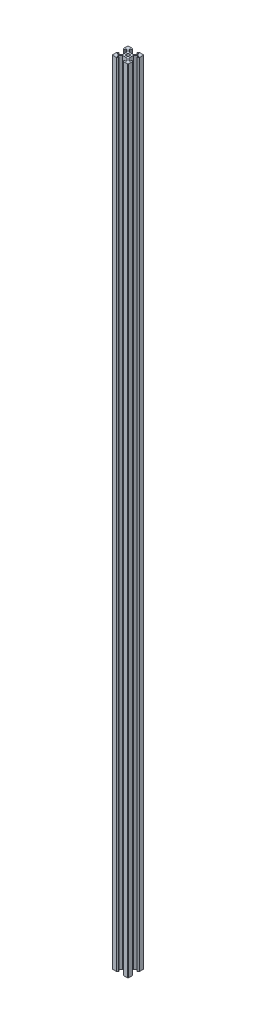
from build123d import *

# Parameters (mm, degrees)
SKETCH2_R              = 2.074585303
VSLOT2020_2020_5_DEPTH = 1000


with BuildPart() as part:
    # Sketch2 → Vslot2020 2020(5) (new body)
    with BuildSketch(Plane.ZX):
        with BuildLine():
            Line((13.9, 7.149086807), (13.9, 12.844511469))
            Line((13.9, 12.844511469), (16.558493656, 15.492177728))
            Line((16.558493656, 15.492177728), (16.550703242, 15.5))
            Line((16.550703242, 15.5), (18.2, 15.5))
            Line((18.2, 15.5), (18.2, 13.12))
            Line((18.2, 13.12), (18.534428266, 13.12))
            Line((18.534428266, 13.12), (20, 14.58))
            Line((20, 14.58), (20, 19.5))
            ThreePointArc((20, 19.5), (19.853553391, 19.853553391), (19.5, 20))
            Line((19.5, 20), (14.575, 20))
            Line((14.575, 20), (13.12, 18.545))
            Line((13.12, 18.545), (13.12, 18.2))
            Line((13.12, 18.2), (15.5, 18.2))
            Line((15.5, 18.2), (15.5, 16.555))
            Line((15.5, 16.555), (12.834142613, 13.9))
            Line((12.834142613, 13.9), (7.155, 13.9))
            Line((7.155, 13.9), (4.5, 16.555))
            Line((4.5, 16.555), (4.5, 18.2))
            Line((4.5, 18.2), (6.875, 18.2))
            Line((6.875, 18.2), (6.875, 18.545))
            Line((6.875, 18.545), (5.42, 20))
            Line((5.42, 20), (0.5, 20))
            ThreePointArc((0.5, 20), (0.146446609, 19.853553391), (0, 19.5))
            Line((0, 19.5), (0, 14.58))
            Line((0, 14.58), (1.46, 13.12))
            Line((1.46, 13.12), (1.8, 13.12))
            Line((1.8, 13.12), (1.8, 15.5))
            Line((1.8, 15.5), (3.445, 15.5))
            Line((3.445, 15.5), (3.439339828, 15.494339828))
            Line((3.439339828, 15.494339828), (6.094339828, 12.839339828))
            Line((6.094339828, 12.839339828), (6.1, 12.845))
            Line((6.1, 12.845), (6.1, 7.149086807))
            Line((6.1, 7.149086807), (3.439339828, 4.5))
            Line((3.439339828, 4.5), (1.8, 4.5))
            Line((1.8, 4.5), (1.8, 6.88))
            Line((1.8, 6.88), (1.46, 6.88))
            Line((1.46, 6.88), (0, 5.42))
            Line((0, 5.42), (0, 0.5))
            ThreePointArc((0, 0.5), (0.146446609, 0.146446609), (0.5, 0))
            Line((0.5, 0), (5.42, 0))
            Line((5.42, 0), (6.875, 1.455))
            Line((6.875, 1.455), (6.875, 1.8))
            Line((6.875, 1.8), (4.5, 1.8))
            Line((4.5, 1.8), (4.5, 3.4393348))
            Line((4.5, 3.4393348), (7.158345795, 6.086117297))
            Line((7.158345795, 6.086117297), (7.144523479, 6.1))
            Line((7.144523479, 6.1), (12.854625295, 6.1))
            Line((12.854625295, 6.1), (12.841221344, 6.086548451))
            Line((12.841221344, 6.086548451), (15.499715, 3.437461644))
            Line((15.499715, 3.437461644), (15.5, 1.8))
            Line((15.5, 1.8), (13.12, 1.8))
            Line((13.12, 1.8), (13.12, 1.455))
            Line((13.12, 1.455), (14.575, 0))
            Line((14.575, 0), (19.5, 0))
            ThreePointArc((19.5, 0), (19.853553391, 0.146446609), (20, 0.5))
            Line((20, 0.5), (20, 5.42))
            Line((20, 5.42), (18.606904708, 6.88))
            Line((18.606904708, 6.88), (18.2, 6.88))
            Line((18.2, 6.88), (18.2, 4.5))
            Line((18.2, 4.5), (16.558493656, 4.5))
            Line((16.558493656, 4.5), (13.9, 7.149086807))
        make_face()
        with Locations((10, 10)):
            Circle(SKETCH2_R, mode=Mode.SUBTRACT)
    extrude(amount=VSLOT2020_2020_5_DEPTH)


solid = part.part
